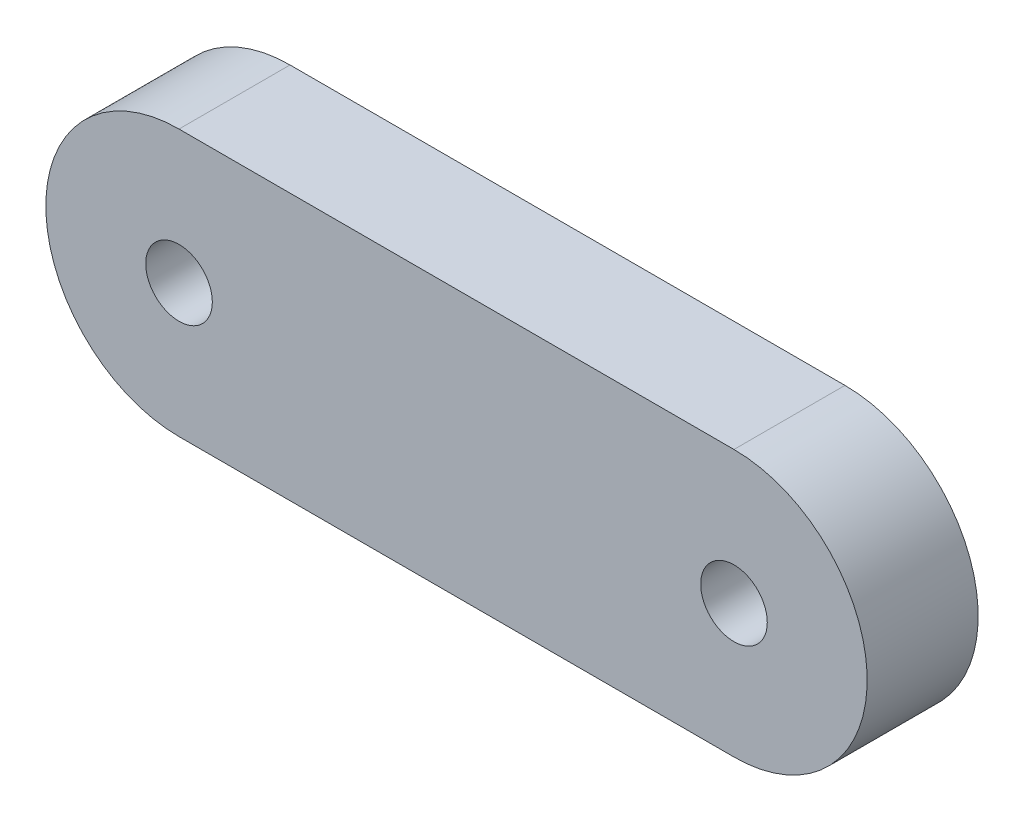
from build123d import *

# Parameters (mm, degrees)
ESQUISSE1_R        = 1.5
BOSS_EXTRU_1_DEPTH = 5


with BuildPart() as part:
    # Esquisse1 → Boss.-Extru.1 (new body)
    with BuildSketch(Plane.XY):
        with BuildLine():
            Line((0, 6), (25, 6))
            ThreePointArc((25, 6), (31, 0), (25, -6))
            Line((25, -6), (0, -6))
            ThreePointArc((0, -6), (-6, 0), (0, 6))
        make_face()
        with Locations((25, 0)):
            Circle(ESQUISSE1_R, mode=Mode.SUBTRACT)
        Circle(ESQUISSE1_R, mode=Mode.SUBTRACT)
    extrude(amount=BOSS_EXTRU_1_DEPTH)


solid = part.part
